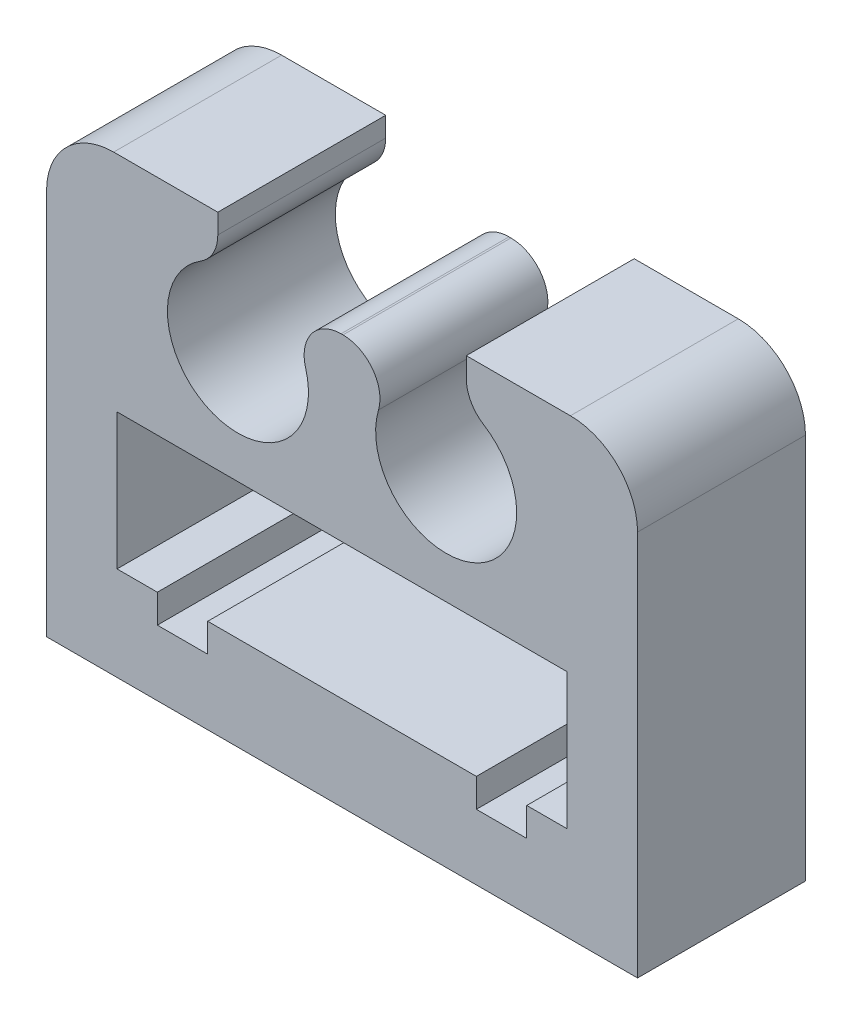
from build123d import *

# Parameters (mm, degrees)
SKETCH1_W           = 17.6
SKETCH1_H           = 13.5
BOSS_EXTRUDE1_DEPTH = 5
SKETCH2_W           = 1.5
SKETCH2_H           = 0.85
SKETCH2_W_2         = 13.4
SKETCH2_H_2         = 4.05
CUT_EXTRUDE2_DEPTH  = 5
SKETCH3_R           = 2.1
SKETCH3_W           = 7.4
SKETCH3_H           = 1.3
CUT_EXTRUDE3_DEPTH  = 5
FILLET1_R           = 1.1
FILLET2_R           = 2


with BuildPart() as part:
    # Sketch1 → Boss-Extrude1 (new body)
    with BuildSketch(Plane.XY):
        with Locations((8.8, 6.75)):
            Rectangle(SKETCH1_W, SKETCH1_H)
    extrude(amount=BOSS_EXTRUDE1_DEPTH)

    # Sketch2 → Cut-Extrude2 (cut)
    with BuildSketch(Plane.XY.offset(5)):
        with Locations((13.55, 2.375)):
            Rectangle(SKETCH2_W, SKETCH2_H)
        with Locations((8.8, 4.825)):
            Rectangle(SKETCH2_W_2, SKETCH2_H_2)
        with Locations((4.05, 2.375)):
            Rectangle(SKETCH2_W, SKETCH2_H)
    extrude(amount=-CUT_EXTRUDE2_DEPTH, mode=Mode.SUBTRACT)

    # Sketch3 → Cut-Extrude3 (cut)
    with BuildSketch(Plane.XY.offset(5)):
        with Locations((5.7, 10.2)):
            Circle(SKETCH3_R)
        with Locations((11.9, 10.2)):
            Circle(SKETCH3_R)
        with Locations((8.8, 12.85)):
            Rectangle(SKETCH3_W, SKETCH3_H)
    extrude(amount=-CUT_EXTRUDE3_DEPTH, mode=Mode.SUBTRACT)

    # Fillet1
    fillet1_edges = [part.edges().sort_by_distance(p)[0] for p in [
        (12.5, 12.21246118, 2.5),
        (5.1, 12.21246118, 2.5),
        (6.340312424, 12.2, 2.5),
        (11.259687576, 12.2, 2.5),
    ]]
    fillet(fillet1_edges, radius=FILLET1_R)

    # Fillet2
    fillet2_edges = [part.edges().sort_by_distance(p)[0] for p in [
        (0, 13.5, 2.5),
        (17.6, 13.5, 2.5),
    ]]
    fillet(fillet2_edges, radius=FILLET2_R)


solid = part.part
